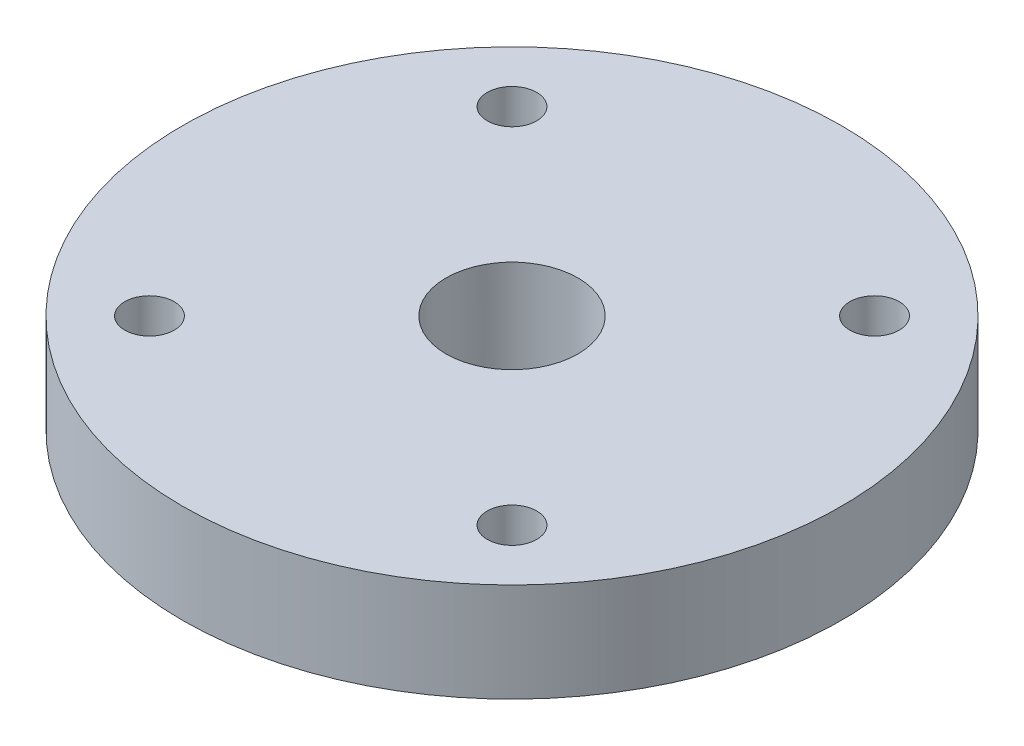
from build123d import *

# Parameters (mm, degrees)
SKETCH1_R                         = 20
ARM_DISTANS_BOSS_EXTRUDE1_DEPTH   = 6
SKETCH2_R                         = 1.5
MOUNTING_HOLES_CUT_EXTRUDE1_DEPTH = 6
SKETCH3_R                         = 4
CUT_EXTRUDE1_DEPTH                = 6


with BuildPart() as part:
    # Sketch1 → Arm Distans Boss-Extrude1 (new body)
    with BuildSketch(Plane(origin=(0, 0, 0), x_dir=(1, 0, 0), z_dir=(0, 1, 0))):
        with Locations(Location((0, 0, 0), (0, 0, 270))):
            Circle(SKETCH1_R)
    extrude(amount=ARM_DISTANS_BOSS_EXTRUDE1_DEPTH)

    # Sketch2 → Mounting Holes Cut-Extrude1 (cut)
    with BuildSketch(Plane(origin=(0, 6, 0), x_dir=(1, 0, 0), z_dir=(0, 1, 0))):
        with Locations(Location((11, 11, 0), (0, 0, 270))):
            Circle(SKETCH2_R)
        with Locations(Location((-11, 11, 0), (0, 0, 270))):
            Circle(SKETCH2_R)
        with Locations(Location((-11, -11, 0), (0, 0, 270))):
            Circle(SKETCH2_R)
        with Locations(Location((11, -11, 0), (0, 0, 270))):
            Circle(SKETCH2_R)
    extrude(amount=-MOUNTING_HOLES_CUT_EXTRUDE1_DEPTH, mode=Mode.SUBTRACT)

    # Sketch3 → Cut-Extrude1 (cut)
    with BuildSketch(Plane.XZ):
        with Locations(Location((0, 0, 0), (0, 0, 270))):
            Circle(SKETCH3_R)
    extrude(amount=-CUT_EXTRUDE1_DEPTH, mode=Mode.SUBTRACT)


solid = part.part
